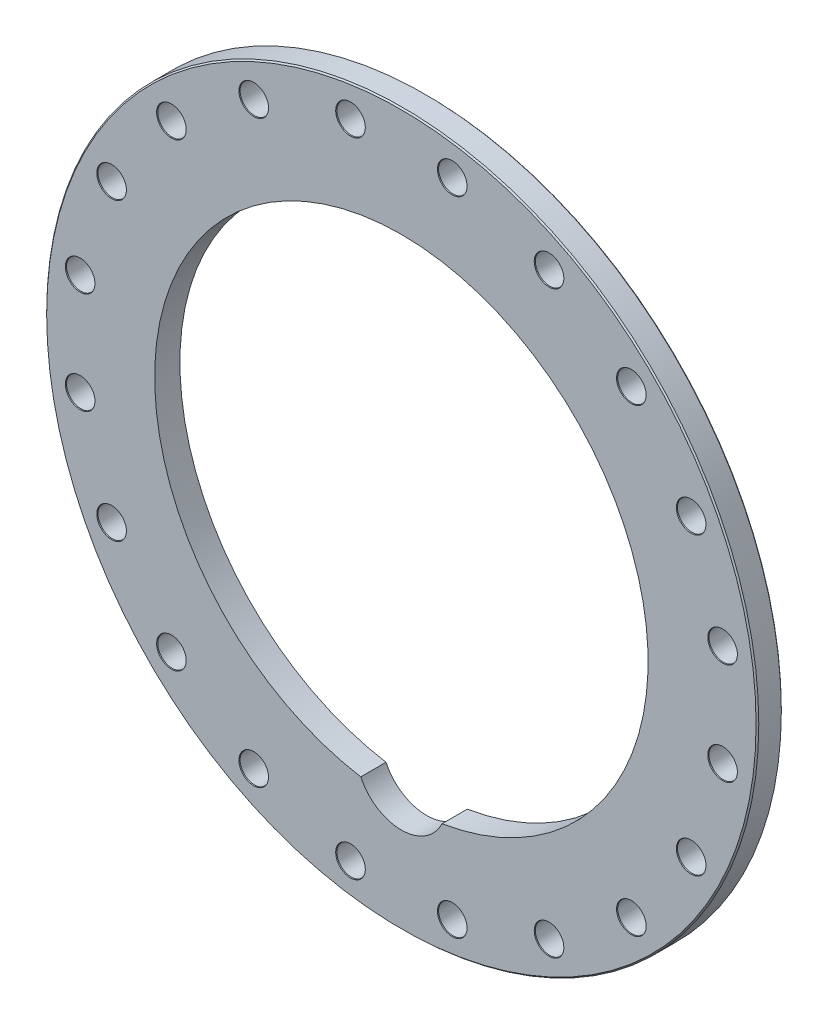
from build123d import *

# Parameters (mm, degrees)
SKETCH1_R               = 201.6125
BASE_EXTRUDE_DEPTH      = 15.875
CUT_EXTRUDE1_DEPTH      = 286.564731607
CUT_EXTRUDE1_DEPTH_BACK = 286.564731607
CIRPATTERN1_COUNT       = 20
CHAMFER1_SIZE           = 0.762


with BuildPart() as part:
    # Sketch1 → Base-Extrude (new body)
    with BuildSketch(Plane.XY):
        Circle(SKETCH1_R)
        with BuildLine():
            ThreePointArc((22.991911078, -137.795), (0, 139.7), (-22.991911078, -137.795))
            ThreePointArc((-22.991911078, -137.795), (0, -152.4), (22.991911078, -137.795))
        make_face(mode=Mode.SUBTRACT)
    extrude(amount=BASE_EXTRUDE_DEPTH)

    # Sketch7 → Cut-Extrude1 (cut, two sides: drawn at the far end of the back side and taken through both)
    with BuildSketch(Plane(origin=(0, 0, 0), x_dir=(0, 0, -1), z_dir=(1, 0, 0)).offset(-CUT_EXTRUDE1_DEPTH_BACK)):
        Polygon((-14.3002, 1056.882009862), (-14.3002, 214.087795121), (-14.3002, -214.538981202), (-14.3002, -1057.333195943), (-1699.888629482, -1057.333195943), (-1699.888629482, 1056.882009862), align=None)
    extrude(amount=CUT_EXTRUDE1_DEPTH + CUT_EXTRUDE1_DEPTH_BACK, mode=Mode.SUBTRACT)

    # Sketch9 → 5/8 (0.625) Diameter Hole1 (revolve, cut)
    with BuildSketch(Plane(origin=(181.882807921, 28.807406737, 14.3002), x_dir=(0, -1, 0), z_dir=(1, 0, 0))):
        Polygon((0, 0), (0, 14.3002), (8.382, 14.3002), (8.1915, 13.840292316), (8.1915, 0.459907684), (8.382, 0), align=None)
    f_5_8_0_625_diameter_hole1 = revolve(axis=Axis((181.882807921, 28.807406737, 20.6502), (0, 0, -1)), mode=Mode.SUBTRACT)

    # CirPattern1: 5/8 (0.625) Diameter Hole1 ×20 about axis
    cirpattern1_axis = Axis((0, 0, -80.9), (0, 0, 1))
    for i in range(1, CIRPATTERN1_COUNT):
        add(f_5_8_0_625_diameter_hole1.rotate(cirpattern1_axis, i * 360 / CIRPATTERN1_COUNT), mode=Mode.SUBTRACT)

    # Chamfer1
    chamfer1_edges = [part.edges().sort_by_distance(p)[0] for p in [
        (-201.6125, 0, 0),
        (-201.6125, 0, 14.3002),
    ]]
    chamfer(chamfer1_edges, length=CHAMFER1_SIZE)


solid = part.part
